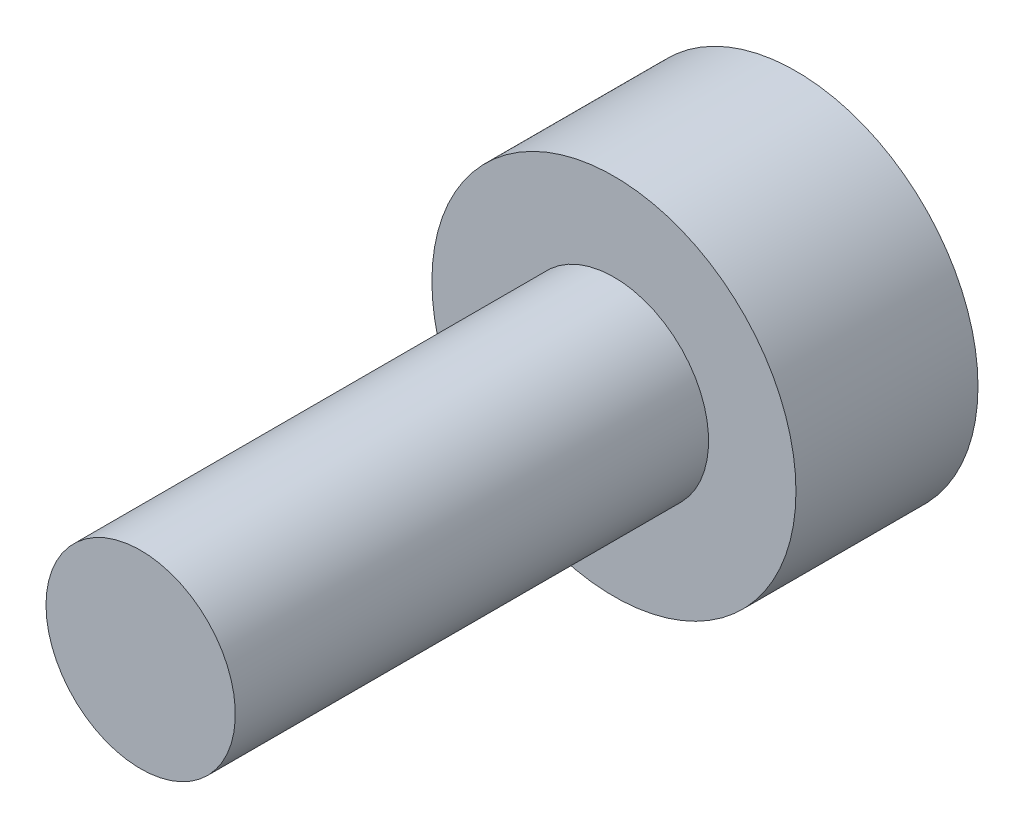
from build123d import *

# Parameters (mm, degrees)
SKETCH1_R           = 2.6
BOSS_EXTRUDE1_DEPTH = 13
SKETCH2_R           = 5
BOSS_EXTRUDE2_DEPTH = 5


with BuildPart() as part:
    # Sketch1 → Boss-Extrude1 (new body)
    with BuildSketch(Plane.XY):
        with Locations(Location((0, 0, 0), (0, 0, 180))):
            Circle(SKETCH1_R)
    extrude(amount=BOSS_EXTRUDE1_DEPTH)

    # Sketch2 → Boss-Extrude2 (add)
    with BuildSketch(Plane(origin=(0, 0, 0), x_dir=(-1, 0, 0), z_dir=(0, 0, -1))):
        Circle(SKETCH2_R)
    extrude(amount=BOSS_EXTRUDE2_DEPTH)


solid = part.part
